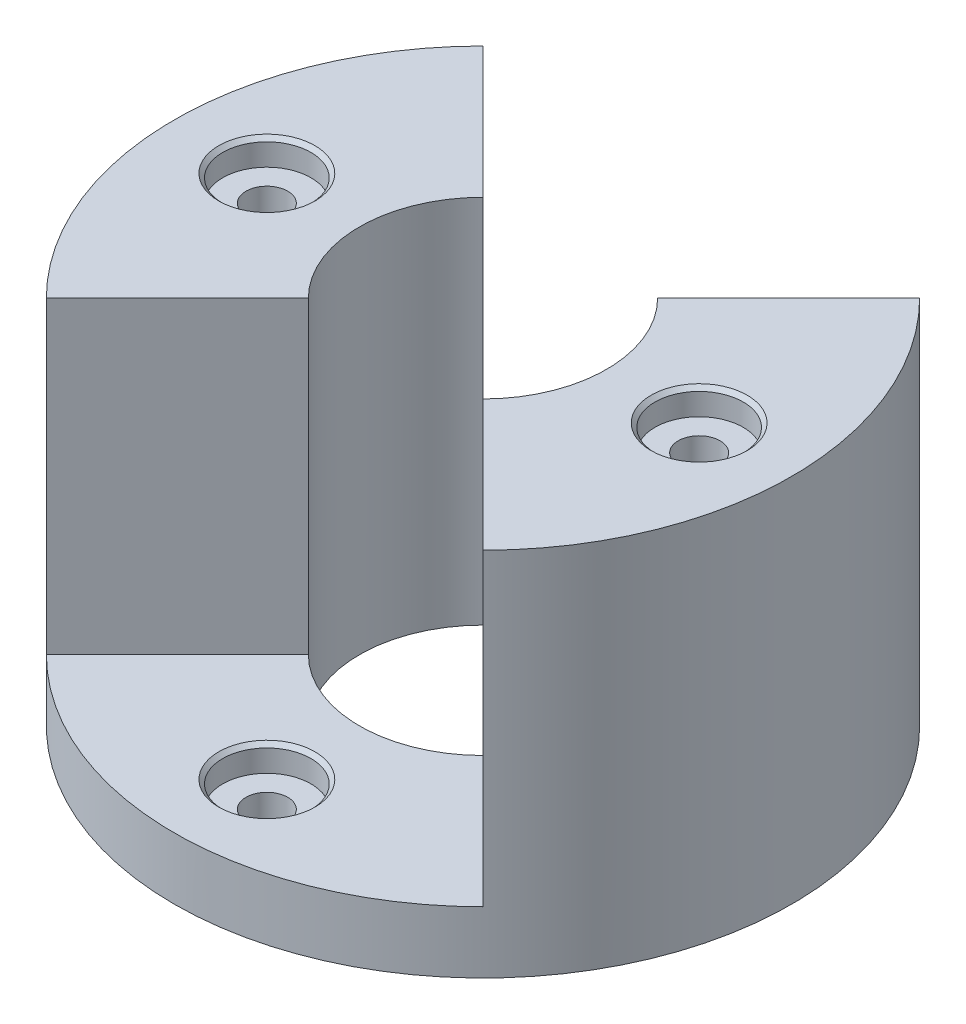
from build123d import *

# Parameters (mm, degrees)
CROQUIS1_R                                     = 50
CROQUIS1_R_2                                   = 20
SALIENTE_EXTRUIR2_DEPTH                        = 10
SALIENTE_EXTRUIR3_DEPTH                        = 60
REFRENTADO_PARA_TORNILLO_CON_CABEZA_2_COUNT    = 2
REFRENTADO_PARA_TORNILLO_CON_CABEZA_2_PITCH    = 70
REFRENTADO_PARA_TORNILLO_CON_CABEZA_3_AT_COUNT = 2
REFRENTADO_PARA_TORNILLO_CON_CABEZA_3_AT_PITCH = 70


with BuildPart() as part:
    # Croquis1 → Saliente-Extruir2 (new body)
    with BuildSketch(Plane(origin=(0, 0, 0), x_dir=(1, 0, 0), z_dir=(0, 1, 0))):
        with Locations(Location((0, 0, 0), (0, 0, 270))):
            Circle(CROQUIS1_R)
        with Locations(Location((0, 0, 0), (0, 0, 270))):
            Circle(CROQUIS1_R_2, mode=Mode.SUBTRACT)
    extrude(amount=SALIENTE_EXTRUIR2_DEPTH)

    # Croquis3 → Saliente-Extruir3 (add)
    with BuildSketch(Plane(origin=(0, 0, 0), x_dir=(1, 0, 0), z_dir=(0, 1, 0))):
        with BuildLine():
            Line((-35.355339, 35.355339), (-14.142136, 14.142136))
            ThreePointArc((-14.142136, 14.142136), (-20, 0), (-14.142136, -14.142136))
            Line((-14.142136, -14.142136), (-35.355339, -35.355339))
            ThreePointArc((-35.355339, -35.355339), (-50, 0), (-35.355339, 35.355339))
        make_face()
        with BuildLine():
            Line((14.142136, 14.142136), (35.355339, 35.355339))
            ThreePointArc((35.355339, 35.355339), (50, 0), (35.355339, -35.355339))
            Line((35.355339, -35.355339), (14.142136, -14.142136))
            ThreePointArc((14.142136, -14.142136), (20, 0), (14.142136, 14.142136))
        make_face()
    extrude(amount=SALIENTE_EXTRUIR3_DEPTH)

    # Croquis15 → Refrentado para tornillo con cabeza tron (revolve, cut)
    with BuildSketch(Plane(origin=(-35, 60, 0), x_dir=(0, 0, 1), z_dir=(1, 0, 0))):
        Polygon((0, 0), (0, 60), (3.38, 60), (3.38, 4.19), (7.145, 4.19), (7.145, 0.635), (7.78, 0), align=None)
    refrentado_para_tornillo_con_cabeza_tron = revolve(axis=Axis((-35, 66.35, 0), (0, -1, 0)), mode=Mode.SUBTRACT)

    # Refrentado para tornillo con cabeza  2: Refrentado para tornillo con cabeza tron ×2
    with Locations(*[(i * REFRENTADO_PARA_TORNILLO_CON_CABEZA_2_PITCH, 0, 0) for i in range(1, REFRENTADO_PARA_TORNILLO_CON_CABEZA_2_COUNT)]):
        add(refrentado_para_tornillo_con_cabeza_tron, mode=Mode.SUBTRACT)

    # Croquis17 → Refrentado para tornillo con cabeza  3 (revolve, cut)
    with BuildSketch(Plane(origin=(0, 10, 35), x_dir=(0, 0, 1), z_dir=(1, 0, 0))):
        Polygon((0, 0), (0, 10), (3.38, 10), (3.38, 4.19), (7.145, 4.19), (7.145, 0.635), (7.78, 0), align=None)
    refrentado_para_tornillo_con_cabeza_3 = revolve(axis=Axis((0, 16.35, 35), (0, -1, 0)), mode=Mode.SUBTRACT)

    # Refrentado para tornillo con cabeza 3 at: Refrentado para tornillo con cabeza  3 ×2
    with Locations(*[(0, 0, -i * REFRENTADO_PARA_TORNILLO_CON_CABEZA_3_AT_PITCH) for i in range(1, REFRENTADO_PARA_TORNILLO_CON_CABEZA_3_AT_COUNT)]):
        add(refrentado_para_tornillo_con_cabeza_3, mode=Mode.SUBTRACT)


solid = part.part
